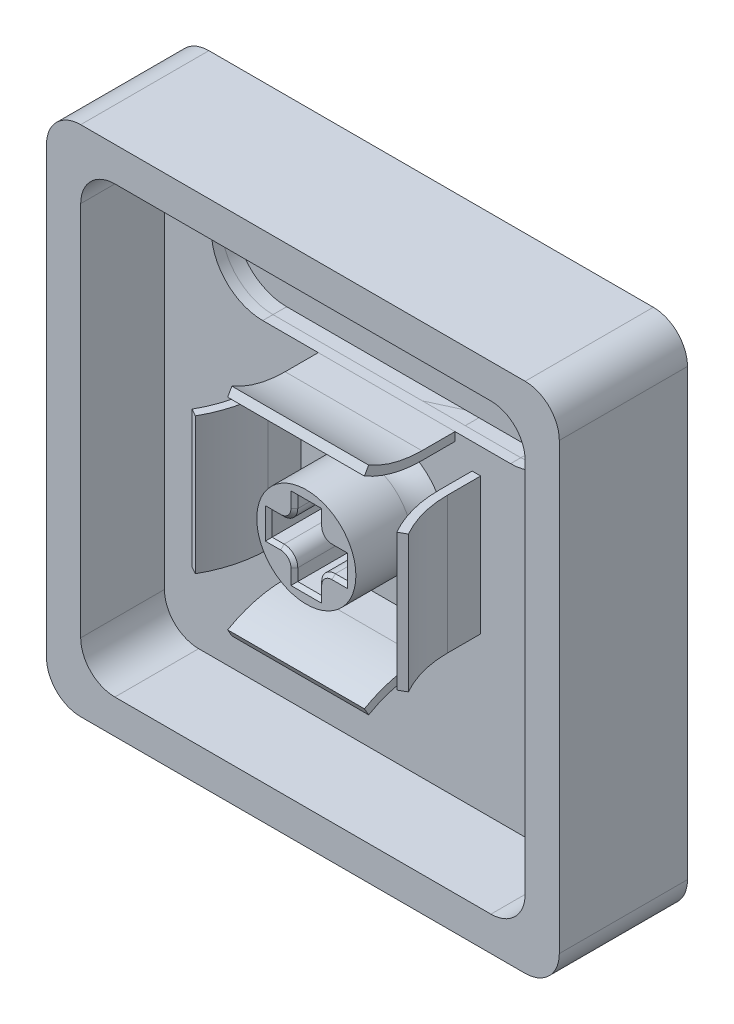
from build123d import *

# Parameters (mm, degrees)
EXTRUDE_1_DEPTH          = 5.5
SKETCH_1_6_R             = 2.9
EXTRUDE_2_DEPTH          = 5.3
EXTRUDE_START            = -2
EXTRUDE_3_DEPTH          = 2
EXTRUDE_4_DEPTH          = 2
CUT_EXTRUDE_1_REACH      = 23.915
EXTRUDE_6_DEPTH          = 1.2
EXTRUDE_9_DEPTH          = 4
FILLET_4_R               = 0.8
CHAMFER_1_SIZE           = 0.2
FILLET_5_R               = 2
EXTRUDE_10_DEPTH         = 0.6
PATTERN_CIRCULAR_6_COUNT = 4


with BuildPart() as part:
    # 草图1 → 凸台-拉伸1 (new body)
    with BuildSketch(Plane.XY):
        with BuildLine():
            ThreePointArc((-15, 13), (-14.414213562, 14.414213562), (-13, 15))
            Line((-13, 15), (13, 15))
            ThreePointArc((13, 15), (14.414213562, 14.414213562), (15, 13))
            Line((15, 13), (15, -13))
            ThreePointArc((15, -13), (14.414213562, -14.414213562), (13, -15))
            Line((13, -15), (-13, -15))
            ThreePointArc((-13, -15), (-14.414213562, -14.414213562), (-15, -13))
            Line((-15, -13), (-15, 13))
        make_face()
        with BuildLine():
            ThreePointArc((-13, -11), (-12.414213562, -12.414213562), (-11, -13))
            Line((-11, -13), (11, -13))
            ThreePointArc((11, -13), (12.414213562, -12.414213562), (13, -11))
            Line((13, -11), (13, 11))
            ThreePointArc((13, 11), (12.414213562, 12.414213562), (11, 13))
            Line((11, 13), (-11, 13))
            ThreePointArc((-11, 13), (-12.414213562, 12.414213562), (-13, 11))
            Line((-13, 11), (-13, -11))
        make_face(mode=Mode.SUBTRACT)
    extrude(amount=EXTRUDE_1_DEPTH)



with BuildPart() as body_2:
    # 草图1<6> → 凸台-拉伸2 (new body)
    with BuildSketch(Plane.XY):
        Circle(SKETCH_1_6_R)
        Polygon((-2.2, -0.7), (-2.2, 0.7), (-0.7, 0.7), (-0.7, 2.2), (0.7, 2.2), (0.7, 0.7), (2.2, 0.7), (2.2, -0.7), (0.7, -0.7), (0.7, -2.2), (-0.7, -2.2), (-0.7, -0.7), align=None, mode=Mode.SUBTRACT)
    extrude(amount=EXTRUDE_2_DEPTH)


with BuildPart() as part_1:
    add(part.part)

    add(body_2.part)  # 凸台-拉伸3 merges body 2
    # 草图1<7> → 凸台-拉伸3 (add)
    with BuildSketch(Plane.XY.offset(EXTRUDE_START)):
        with BuildLine():
            Line((-13, 15), (13, 15))
            ThreePointArc((13, 15), (14.414213562, 14.414213562), (15, 13))
            Line((15, 13), (15, -13))
            ThreePointArc((15, -13), (14.414213562, -14.414213562), (13, -15))
            Line((13, -15), (-13, -15))
            ThreePointArc((-13, -15), (-14.414213562, -14.414213562), (-15, -13))
            Line((-15, -13), (-15, 13))
            ThreePointArc((-15, 13), (-14.414213562, 14.414213562), (-13, 15))
        make_face()
    extrude(amount=EXTRUDE_3_DEPTH)

    # 草图3 → 凸台-拉伸4 (add)
    with BuildSketch(Plane.XY):
        Polygon((0.7, 0.7), (0.7, 2.2), (-0.7, 2.2), (-0.7, 0.7), (-2.2, 0.7), (-2.2, -0.7), (-0.7, -0.7), (-0.7, -2.2), (0.7, -2.2), (0.7, -0.7), (2.2, -0.7), (2.2, 0.7), align=None)
    extrude(amount=EXTRUDE_4_DEPTH)

    # 草图5 → 切除-拉伸1 (cut, up to next)
    with BuildSketch(Plane.XY, mode=Mode.PRIVATE) as cut_extrude_1_sk1:
        with BuildLine():
            Line((7.25, 5.5), (-7.25, 5.5))
            ThreePointArc((-7.25, 5.5), (-10.25, 8.5), (-7.25, 11.5))
            Line((-7.25, 11.5), (7.25, 11.5))
            ThreePointArc((7.25, 11.5), (10.25, 8.5), (7.25, 5.5))
        make_face()
    cut_extrude_1_tool1 = extrude(cut_extrude_1_sk1.sketch, amount=-CUT_EXTRUDE_1_REACH, mode=Mode.PRIVATE) & part_1.part
    add(cut_extrude_1_tool1.solids().sort_by_distance((0, 8.5, 0))[0], mode=Mode.SUBTRACT)

    # 圆角4
    fillet_4_edges = [part_1.edges().sort_by_distance(p)[0] for p in [
        (0.7, 0.7, 3.65),
        (0.7, -0.7, 3.65),
        (-0.7, -0.7, 3.65),
        (-0.7, 0.7, 3.65),
    ]]
    fillet(fillet_4_edges, radius=FILLET_4_R)

    # 倒角1
    chamfer_1_edges = [part_1.edges().sort_by_distance(p)[0] for p in [
        (1.85, 0.7, 5.3),
        (1.85, -0.7, 5.3),
        (0.7, -1.85, 5.3),
        (-0.7, -1.85, 5.3),
        (0.934314575, -0.934314575, 5.3),
        (-0.934314575, -0.934314575, 5.3),
        (0.934314575, 0.934314575, 5.3),
        (-0.934314575, 0.934314575, 5.3),
        (0, -2.2, 5.3),
        (-1.85, -0.7, 5.3),
        (-2.2, 0, 5.3),
        (-0.7, 1.85, 5.3),
        (0, 2.2, 5.3),
        (0.7, 1.85, 5.3),
        (2.2, 0, 5.3),
        (-1.85, 0.7, 5.3),
    ]]
    chamfer(chamfer_1_edges, length=CHAMFER_1_SIZE)

    # 圆角5
    fillet_5_edges = [part_1.edges().sort_by_distance(p)[0] for p in [
        (-2.9, 0, 0),
    ]]
    fillet(fillet_5_edges, radius=FILLET_5_R)


with BuildPart() as body_2_2:
    # 草图6 → 凸台-拉伸6 (new body)
    with BuildSketch(Plane(origin=(0, 0, -2), x_dir=(-1, 0, 0), z_dir=(0, 0, -1))):
        with BuildLine():
            Line((7.25, 5.5), (-7.25, 5.5))
            ThreePointArc((-7.25, 5.5), (-10.25, 8.5), (-7.25, 11.5))
            Line((-7.25, 11.5), (7.25, 11.5))
            ThreePointArc((7.25, 11.5), (10.25, 8.5), (7.25, 5.5))
        make_face()
    extrude(amount=-EXTRUDE_6_DEPTH)


with BuildPart() as body_3:
    # 草图9 → 凸台-拉伸9 (new, symmetric)
    with BuildSketch(Plane(origin=(0, 0, 0), x_dir=(1, 0, 0), z_dir=(0, 1, 0))):
        with BuildLine():
            Line((5.89422954, -5.902170249), (6.328194027, -5.653826085))
            ThreePointArc((6.328194027, -5.653826085), (5.710584389, -4.150618449), (5.5, -2.53918149))
            Line((5.5, -2.53918149), (5.5, 1.163381533))
            Line((5.5, 1.163381533), (5, 1.163381533))
            Line((5, 1.163381533), (5, -2.53918149))
            ThreePointArc((5, -2.53918149), (5.227375199, -4.279105329), (5.89422954, -5.902170249))
        make_face()
    extrude(amount=EXTRUDE_9_DEPTH, both=True)


with BuildPart() as body_4:
    # 草图10 → 凸台-拉伸10 (new body)
    with BuildSketch(Plane.XY):
        with BuildLine():
            Line((-13, 11), (-13, -11))
            ThreePointArc((-13, -11), (-12.414213562, -12.414213562), (-11, -13))
            Line((-11, -13), (11, -13))
            ThreePointArc((11, -13), (12.414213562, -12.414213562), (13, -11))
            Line((13, -11), (13, 11))
            ThreePointArc((13, 11), (12.414213562, 12.414213562), (11, 13))
            Line((11, 13), (-11, 13))
            ThreePointArc((-11, 13), (-12.414213562, 12.414213562), (-13, 11))
        make_face()
        with BuildLine():
            Line((7.25, 5.5), (-7.25, 5.5))
            ThreePointArc((-7.25, 5.5), (-10.25, 8.5), (-7.25, 11.5))
            Line((-7.25, 11.5), (7.25, 11.5))
            ThreePointArc((7.25, 11.5), (10.25, 8.5), (7.25, 5.5))
        make_face(mode=Mode.SUBTRACT)
    extrude(amount=EXTRUDE_10_DEPTH)


with BuildPart() as pattern_circular_6_1:
    # 阵列(圆周)6: pattern copy
    add(body_3.part.rotate(Axis((0, 0, 0), (0, 0, 1)), 1 * 360 / PATTERN_CIRCULAR_6_COUNT))


with BuildPart() as pattern_circular_6_2:
    # 阵列(圆周)6: pattern copy
    add(body_3.part.rotate(Axis((0, 0, 0), (0, 0, 1)), 2 * 360 / PATTERN_CIRCULAR_6_COUNT))


with BuildPart() as pattern_circular_6_3:
    # 阵列(圆周)6: pattern copy
    add(body_3.part.rotate(Axis((0, 0, 0), (0, 0, 1)), 3 * 360 / PATTERN_CIRCULAR_6_COUNT))


solid = Compound([part_1.part, body_2_2.part, body_3.part, body_4.part, pattern_circular_6_1.part, pattern_circular_6_2.part, pattern_circular_6_3.part])
